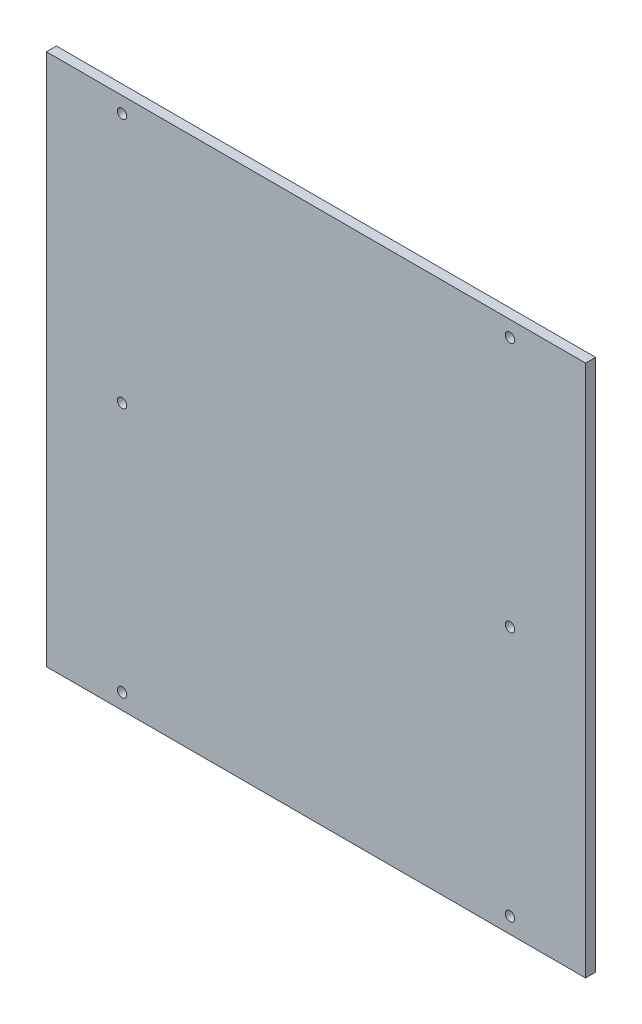
from build123d import *

# Parameters (mm, degrees)
SKETCH1_W           = 133.35
SKETCH1_H           = 169.333333333
SKETCH1_R           = 1.5
BOSS_EXTRUDE1_DEPTH = 3.175
SKETCH3_W           = 19.05
SKETCH3_H           = 169.333333333
BOSS_EXTRUDE2_DEPTH = 3.175


with BuildPart() as part:
    # Sketch1 → Boss-Extrude1 (new body)
    with BuildSketch(Plane.XY):
        with Locations((66.675, 84.666666667)):
            Rectangle(SKETCH1_W, SKETCH1_H)
        with Locations((5, 5)):
            Circle(SKETCH1_R, mode=Mode.SUBTRACT)
        with Locations(Location((5, 164.333333333, 0), (0, 0, 180))):
            Circle(SKETCH1_R, mode=Mode.SUBTRACT)
        with Locations((5, 84.666666667)):
            Circle(SKETCH1_R, mode=Mode.SUBTRACT)
        with Locations((128.35, 164.333333333)):
            Circle(SKETCH1_R, mode=Mode.SUBTRACT)
        with Locations(Location((128.35, 84.666666667, 0), (0, 0, 180))):
            Circle(SKETCH1_R, mode=Mode.SUBTRACT)
        with Locations(Location((128.35, 5, 0), (0, 0, 180))):
            Circle(SKETCH1_R, mode=Mode.SUBTRACT)
    extrude(amount=BOSS_EXTRUDE1_DEPTH)

    # Sketch3 → Boss-Extrude2 (add)
    with BuildSketch(Plane.XY.offset(3.175)):
        with Locations((-9.525, 84.666666667)):
            Rectangle(SKETCH3_W, SKETCH3_H)
        with Locations((142.875, 84.666666667)):
            Rectangle(SKETCH3_W, SKETCH3_H)
    extrude(amount=-BOSS_EXTRUDE2_DEPTH)


solid = part.part
